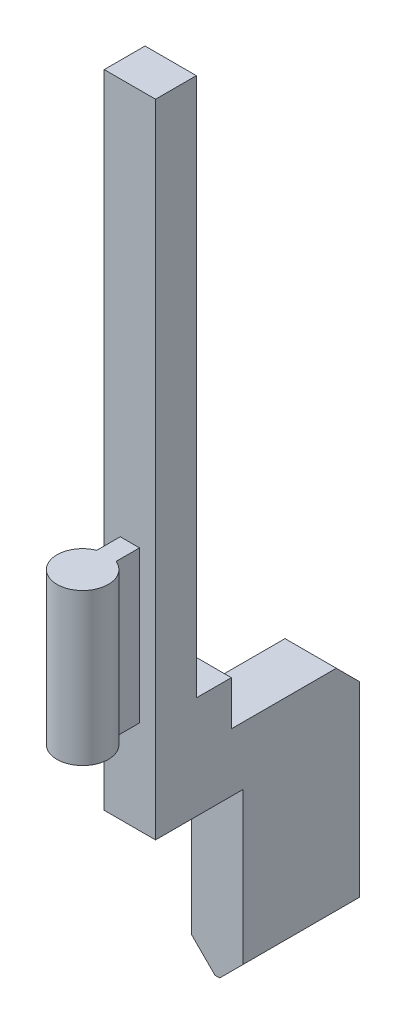
from build123d import *

# Parameters (mm, degrees)
SZKIC1_W                    = 4.4
SZKIC1_H                    = 21
DODANIE_WYCI_GNI_CIE1_DEPTH = 6.5
SZKIC3_R                    = 2.2
SZKIC3_W                    = 1.65
SZKIC3_H                    = 4.05
DODANIE_WYCI_GNI_CIE2_DEPTH = 13
SKETCH1_W                   = 4.4
SKETCH1_H                   = 5
BOSS_EXTRUDE1_DEPTH         = 11
SKETCH3_W                   = 4.4
SKETCH3_H                   = 10
BOSS_EXTRUDE3_DEPTH         = 15
CHAMFER1_SIZE               = 2
SKETCH5_W                   = 4.4
SKETCH5_H                   = 3
CUT_EXTRUDE1_DEPTH          = 12.2
SZKIC4_W                    = 4.4
SZKIC4_H                    = 3.5
DODANIE_WYCI_GNI_CIE3_DEPTH = 34


with BuildPart() as part:
    # Szkic1 → Dodanie-wyciągnięcie1 (new body)
    with BuildSketch(Plane.XY):
        Rectangle(SZKIC1_W, SZKIC1_H)
    extrude(amount=DODANIE_WYCI_GNI_CIE1_DEPTH)

    # Szkic3 → Dodanie-wyciągnięcie2 (add)
    with BuildSketch(Plane(origin=(0, 10.5, 0), x_dir=(1, 0, 0), z_dir=(0, 1, 0))):
        with Locations((0, -10.55)):
            Circle(SZKIC3_R)
        with Locations((0, -8.525)):
            Rectangle(SZKIC3_W, SZKIC3_H)
    extrude(amount=-DODANIE_WYCI_GNI_CIE2_DEPTH)

    # Sketch1 → Boss-Extrude1 (add)
    with BuildSketch(Plane(origin=(0, 0, 0), x_dir=(-1, 0, 0), z_dir=(0, 0, -1))):
        with Locations((0, -8)):
            Rectangle(SKETCH1_W, SKETCH1_H)
    extrude(amount=BOSS_EXTRUDE1_DEPTH)

    # Sketch3 → Boss-Extrude3 (add)
    with BuildSketch(Plane.XZ.offset(10.5)):
        with Locations((0, -6)):
            Rectangle(SKETCH3_W, SKETCH3_H)
    extrude(amount=BOSS_EXTRUDE3_DEPTH)

    # Chamfer1
    chamfer1_edges = [part.edges().sort_by_distance(p)[0] for p in [
        (0, -5.5, -11),
        (2.2, -25.5, -6),
        (-2.2, -25.5, -6),
    ]]
    chamfer(chamfer1_edges, length=CHAMFER1_SIZE)

    # Sketch5 → Cut-Extrude1 (cut)
    with BuildSketch(Plane(origin=(0, 10.5, 0), x_dir=(1, 0, 0), z_dir=(0, 1, 0))):
        with Locations((0, -1.5)):
            Rectangle(SKETCH5_W, SKETCH5_H)
    extrude(amount=-CUT_EXTRUDE1_DEPTH, mode=Mode.SUBTRACT)

    # Szkic4 → Dodanie-wyciągnięcie3 (add)
    with BuildSketch(Plane(origin=(0, 10.5, 0), x_dir=(1, 0, 0), z_dir=(0, 1, 0))):
        with Locations((0, -4.75)):
            Rectangle(SZKIC4_W, SZKIC4_H)
    extrude(amount=DODANIE_WYCI_GNI_CIE3_DEPTH)


solid = part.part
